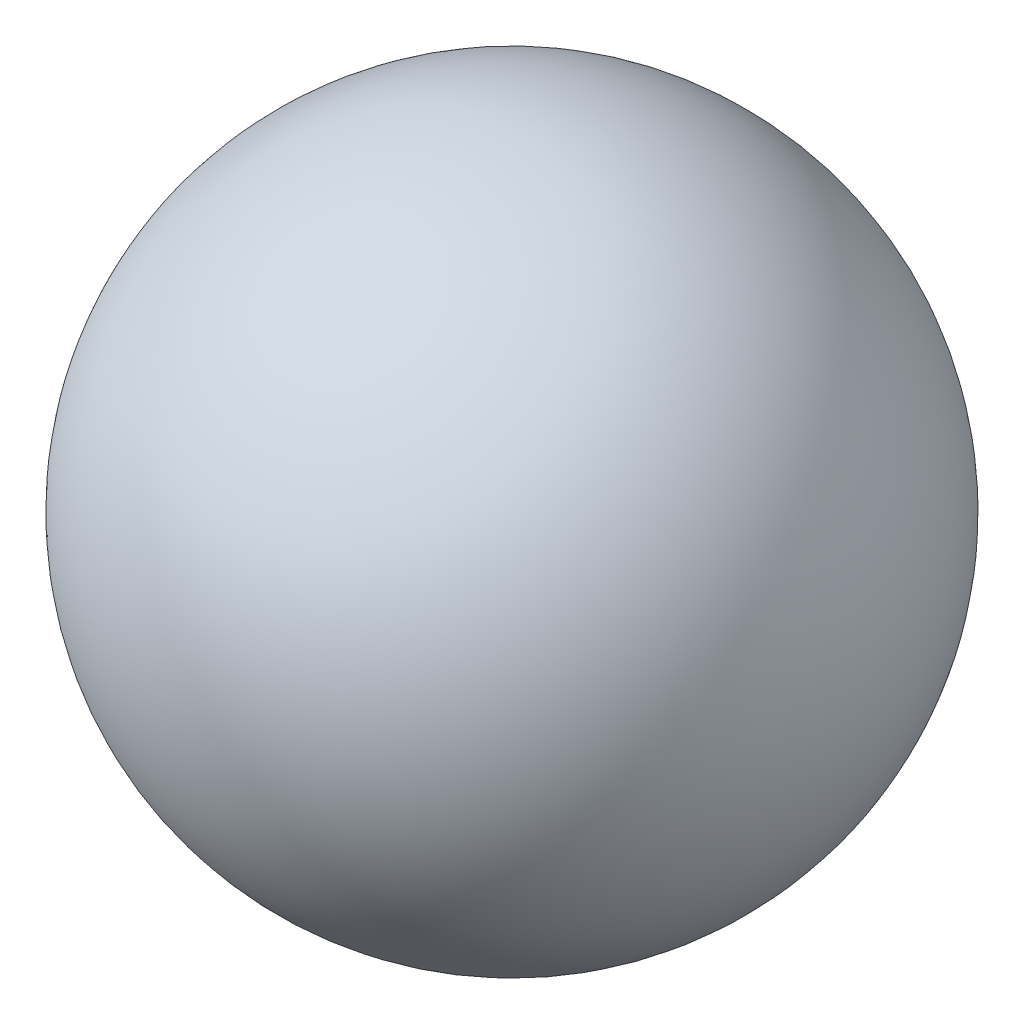
from build123d import *


with BuildPart() as part:
    # Sketch1 → Revolve1 (revolve)
    with BuildSketch(Plane.XY):
        with BuildLine():
            Line((-111.737704918, 0), (-87.737704918, 0))
            ThreePointArc((-87.737704918, 0), (-99.737704918, -12), (-111.737704918, 0))
        make_face()
    revolve(axis=Axis((-111.737704918, 0, 0), (1, 0, 0)))


solid = part.part
